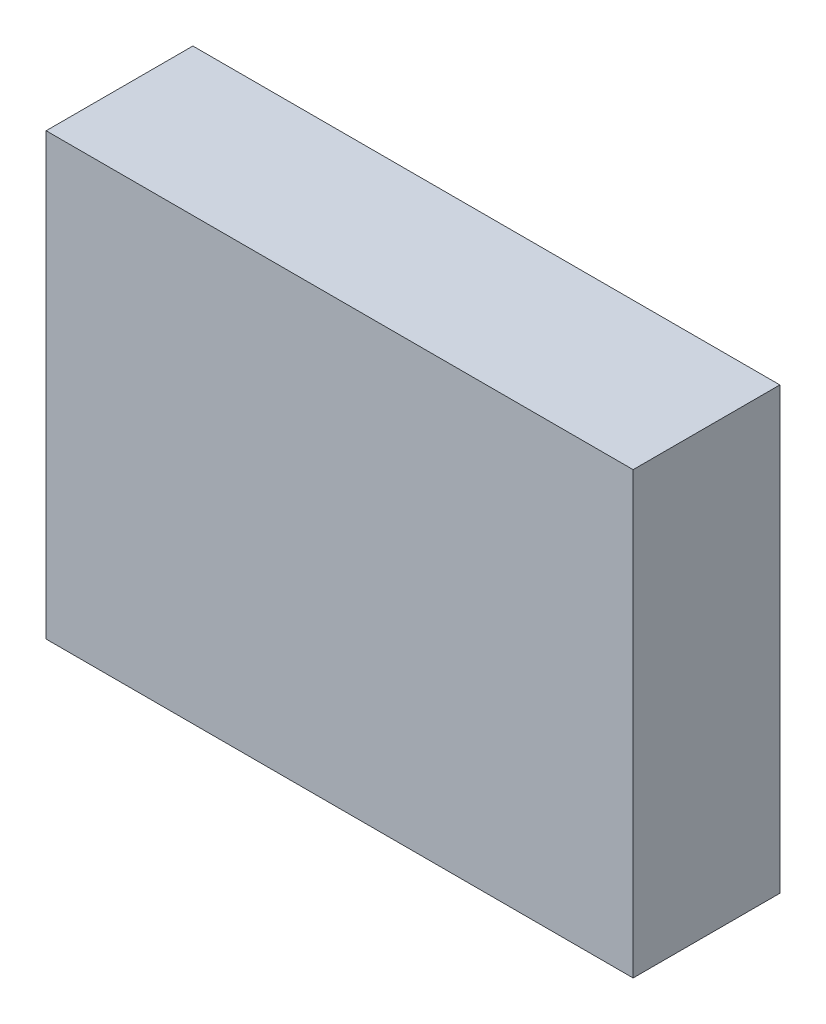
from build123d import *

# Parameters (mm, degrees)
BOSS_EXTRUDE2_DEPTH             = 300
BOSS_EXTRUDE2_DEPTH_BACK        = 300
SKETCH1_W                       = 450
SKETCH1_H                       = 150
F_2_0MM_DOWEL_HOLE1_D           = 2
F_2_0MM_DOWEL_HOLE1_DEPTH       = 10
F_2_0MM_DOWEL_HOLE1_CSINK_D     = 2.05
F_2_0MM_DOWEL_HOLE1_CSINK_ANGLE = 90
F_2_0MM_DOWEL_HOLE1_TIP         = 0.600860619
F_2_0MM_DOWEL_HOLE2_D           = 2
F_2_0MM_DOWEL_HOLE2_DEPTH       = 10
F_2_0MM_DOWEL_HOLE2_CSINK_D     = 2.05
F_2_0MM_DOWEL_HOLE2_CSINK_ANGLE = 90
F_2_0MM_DOWEL_HOLE2_TIP         = 0.600860619


with BuildPart() as part:
    # Sketch1 → Boss-Extrude2 (new, two sides: drawn at the far end of the back side and taken through both)
    with BuildSketch(Plane.YZ.offset(-BOSS_EXTRUDE2_DEPTH_BACK)):
        with Locations((-225, 75)):
            Rectangle(SKETCH1_W, SKETCH1_H)
    extrude(amount=BOSS_EXTRUDE2_DEPTH + BOSS_EXTRUDE2_DEPTH_BACK)

    # Ø2.0mm Dowel Hole1
    with Locations(Plane(origin=(0, 0, 0), x_dir=(1, 0, 0), z_dir=(0, 0, -1))):
        with Locations((37.5, 145), (-37.5, 305), (-37.5, 145), (37.5, 305)):
            CounterSinkHole(F_2_0MM_DOWEL_HOLE1_D / 2, F_2_0MM_DOWEL_HOLE1_CSINK_D / 2, depth=F_2_0MM_DOWEL_HOLE1_DEPTH, counter_sink_angle=F_2_0MM_DOWEL_HOLE1_CSINK_ANGLE)
            with Locations((0, 0, -(F_2_0MM_DOWEL_HOLE1_DEPTH + F_2_0MM_DOWEL_HOLE1_TIP / 2))):  # 118° drill point
                Cone(0, F_2_0MM_DOWEL_HOLE1_D / 2, F_2_0MM_DOWEL_HOLE1_TIP, mode=Mode.SUBTRACT)

    # Ø2.0mm Dowel Hole2
    with Locations(Plane(origin=(0, 0, 0), x_dir=(1, 0, 0), z_dir=(0, 0, -1))):
        with Locations((-15, 12.5), (-15, 87.5), (15, 87.5), (15, 12.5)):
            CounterSinkHole(F_2_0MM_DOWEL_HOLE2_D / 2, F_2_0MM_DOWEL_HOLE2_CSINK_D / 2, depth=F_2_0MM_DOWEL_HOLE2_DEPTH, counter_sink_angle=F_2_0MM_DOWEL_HOLE2_CSINK_ANGLE)
            with Locations((0, 0, -(F_2_0MM_DOWEL_HOLE2_DEPTH + F_2_0MM_DOWEL_HOLE2_TIP / 2))):  # 118° drill point
                Cone(0, F_2_0MM_DOWEL_HOLE2_D / 2, F_2_0MM_DOWEL_HOLE2_TIP, mode=Mode.SUBTRACT)


solid = part.part
